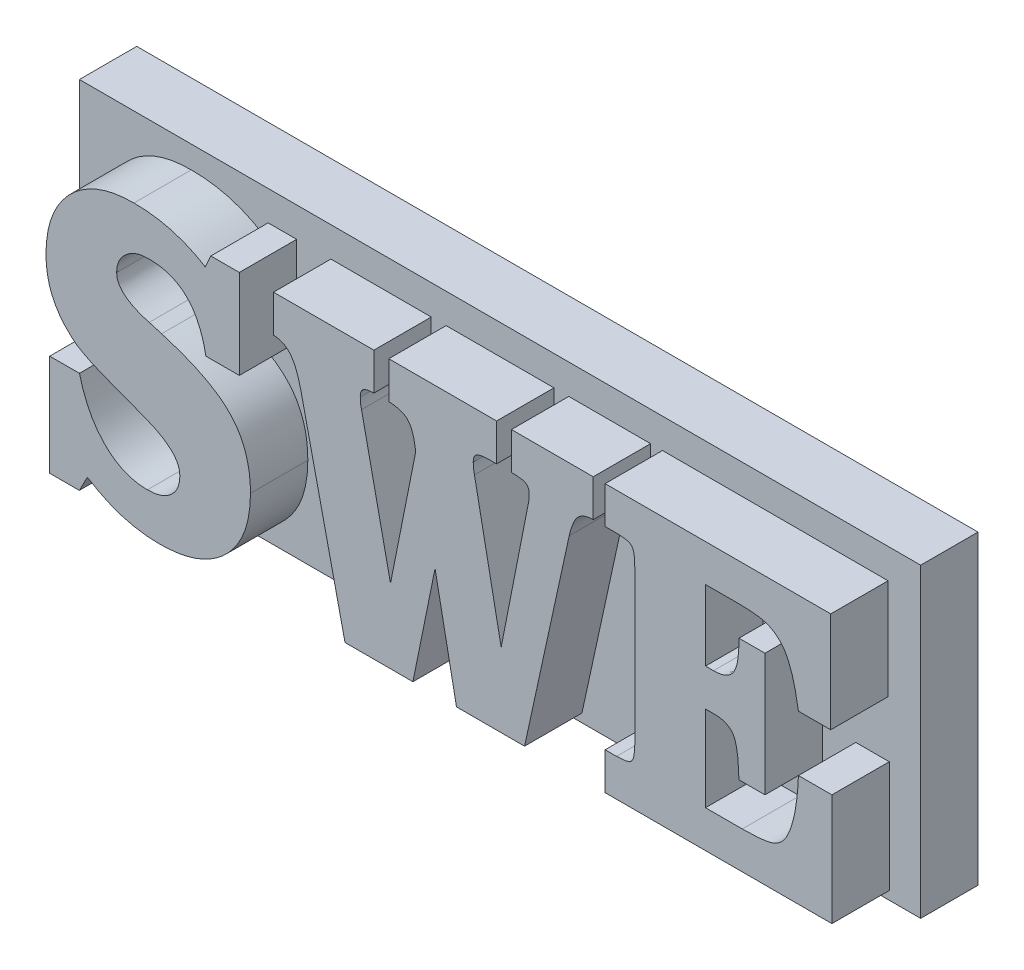
from build123d import *

# Parameters (mm, degrees)
SKETCH1_W           = 139.7
SKETCH1_H           = 50.8
BOSS_EXTRUDE1_DEPTH = 9.525
BOSS_EXTRUDE2_DEPTH = 9.525
SKETCH3_W           = 3.302
SKETCH3_H           = 38.1
CUT_EXTRUDE1_DEPTH  = 6.35
BOSS_EXTRUDE4_DEPTH = 3.175
LPATTERN1_COUNT     = 3
LPATTERN1_PITCH     = 55.372


with BuildPart() as part:
    # Sketch1 → Boss-Extrude1 (new body)
    with BuildSketch(Plane.XY):
        Rectangle(SKETCH1_W, SKETCH1_H)
    extrude(amount=BOSS_EXTRUDE1_DEPTH)

    # Sketch2 → Boss-Extrude2 (add)
    with BuildSketch(Plane.XY.offset(9.525)):
        with BuildLine():
            Line((-65.255069444, -7.328035102), (-60.316180556, -7.328035102))
            add(Edge.make_bspline(
                [(-60.316180556, -7.328035102), (-60.206025525, -7.754110071), (-59.990466561, -8.587882972), (-59.57876222, -9.786605348), (-59.126462153, -10.917441051), (-58.628987413, -11.981915952), (-58.065668641, -12.970665932), (-57.450470062, -13.887133459), (-56.779903272, -14.729446916), (-56.071234499, -15.504683858), (-55.307240176, -16.186472595), (-54.513207402, -16.790958162), (-53.682092583, -17.306400474), (-52.81374909, -17.719662713), (-51.915062934, -18.041684677), (-50.985280985, -18.275443723), (-50.017943274, -18.410709827), (-49.361646539, -18.430523897), (-49.030047743, -18.440535102)],
                knots=[0, 0, 0, 0, 1.231253551, 2.409401909, 3.544062105, 4.638986449, 5.694903985, 6.725712604, 7.724967103, 8.705652409, 9.661497736, 10.586602625, 11.495680479, 12.393283466, 13.272841424, 14.163333945, 15.072010843, 16, 16, 16, 16], degree=3))
            add(Edge.make_bspline(
                [(-49.030047743, -18.440535102), (-48.642415448, -18.429261444), (-47.896741689, -18.407574729), (-46.846196868, -18.144033305), (-45.902115592, -17.755852062), (-45.107102547, -17.17500219), (-44.455423469, -16.473058093), (-43.9784677, -15.654499241), (-43.701871129, -14.727975053), (-43.666013533, -14.079085764), (-43.647430556, -13.742802897)],
                knots=[0, 0, 0, 0, 1.155836752, 2.223439966, 3.21785095, 4.188715844, 5.140993966, 6.062463377, 6.995883609, 8, 8, 8, 8], degree=3))
            add(Edge.make_bspline(
                [(-43.647430556, -13.742802897), (-43.663149577, -13.47353183), (-43.694649518, -12.933929379), (-43.987301758, -12.150306256), (-44.450953036, -11.411180065), (-45.095890512, -10.704764893), (-45.92633521, -10.05040994), (-46.919578166, -9.405114697), (-48.102646477, -8.815709507), (-48.963174589, -8.466653788), (-49.415898438, -8.283015571)],
                knots=[0, 0, 0, 0, 0.764697947, 1.532407066, 2.350892576, 3.239367693, 4.242159257, 5.354958224, 6.608443496, 8, 8, 8, 8], degree=3))
            add(Edge.make_bspline(
                [(-49.415898438, -8.283015571), (-49.711876164, -8.174140008), (-50.269574643, -7.968990327), (-51.056316502, -7.671942127), (-51.737318227, -7.388826368), (-52.161797757, -7.215314302), (-52.358009983, -7.135109755)],
                knots=[0, 0, 0, 0, 1.19820127, 2.257720648, 3.19464548, 4, 4, 4, 4], degree=3))
            add(Edge.make_bspline(
                [(-52.358009983, -7.135109755), (-52.976331133, -6.912601958), (-54.142496747, -6.492947962), (-55.770676846, -5.863185146), (-57.18054879, -5.301355015), (-58.375065119, -4.77547155), (-59.380771163, -4.282055322), (-60.223736674, -3.807913256), (-60.927397917, -3.362689203), (-61.321993318, -3.038975011), (-61.502671441, -2.890752116)],
                knots=[0, 0, 0, 0, 1.557479773, 2.937436884, 4.137546574, 5.154336823, 6.030273639, 6.791246119, 7.446533379, 8, 8, 8, 8], degree=3))
            add(Edge.make_bspline(
                [(-61.502671441, -2.890752116), (-61.856694647, -2.559818022), (-62.552580063, -1.9093177), (-63.463427304, -0.835586889), (-64.218824358, 0.300034071), (-64.837009478, 1.487953147), (-65.304341366, 2.748939002), (-65.625653794, 4.08676024), (-65.837208487, 5.504459978), (-65.860493543, 6.478196416), (-65.872430556, 6.977379394)],
                knots=[0, 0, 0, 0, 1.042021876, 2.048249421, 3.021008834, 3.970868383, 4.923042701, 5.906249433, 6.926645239, 8, 8, 8, 8], degree=3))
            add(Edge.make_bspline(
                [(-65.872430556, 6.977379394), (-65.863688391, 7.515049875), (-65.846562668, 8.568335384), (-65.643040257, 10.103358244), (-65.341866497, 11.566000675), (-64.894035891, 12.943364449), (-64.336619917, 14.246087746), (-63.64316236, 15.465120252), (-62.822174231, 16.600821584), (-61.887839301, 17.654646417), (-60.843509471, 18.598224413), (-59.716327277, 19.432529951), (-58.500216205, 20.129214182), (-57.210372119, 20.701136442), (-55.839785823, 21.146263128), (-54.389568888, 21.464427961), (-52.854590942, 21.646323448), (-51.805434989, 21.673840767), (-51.267981771, 21.68793712)],
                knots=[0, 0, 0, 0, 1.104369362, 2.163437066, 3.177052802, 4.169792589, 5.134757139, 6.084806065, 7.045893009, 8.010178405, 8.973965451, 9.933597097, 10.886927326, 11.848491309, 12.828656977, 13.843672126, 14.895373608, 16, 16, 16, 16], degree=3))
            add(Edge.make_bspline(
                [(-51.267981771, 21.68793712), (-50.720977514, 21.679718978), (-49.64079763, 21.663490455), (-48.052217957, 21.503751605), (-46.518448435, 21.253257858), (-45.03417623, 20.90710523), (-43.587976982, 20.4481291), (-42.165057386, 19.887817888), (-40.764886406, 19.214811723), (-39.865718817, 18.684847747), (-39.412719184, 18.417852485)],
                knots=[0, 0, 0, 0, 1.053163087, 2.079701514, 3.071259132, 4.044569555, 5.012051423, 5.990626845, 6.987680035, 8, 8, 8, 8], degree=3))
            Line((-39.412719184, 18.417852485), (-38.505970052, 20.453214898))
            Line((-38.505970052, 20.453214898), (-33.769652778, 20.453214898))
            Line((-33.769652778, 20.453214898), (-33.769652778, 5.636548231))
            Line((-33.769652778, 5.636548231), (-39.325902778, 5.636548231))
            add(Edge.make_bspline(
                [(-39.325902778, 5.636548231), (-39.403111047, 6.013420139), (-39.553731344, 6.748633605), (-39.826979311, 7.812396577), (-40.169421953, 8.794961297), (-40.541008128, 9.707565454), (-40.969017408, 10.542100707), (-41.439130765, 11.306495755), (-41.961250421, 11.995970149), (-42.535544136, 12.607916091), (-43.15177463, 13.148749295), (-43.81663345, 13.619788669), (-44.533329969, 14.013408837), (-45.297363484, 14.34426942), (-46.115556828, 14.597036876), (-46.982840427, 14.76405058), (-47.898610043, 14.874807227), (-48.524885199, 14.889442751), (-48.846768663, 14.896964898)],
                knots=[0, 0, 0, 0, 1.258218904, 2.454572661, 3.588660999, 4.658929361, 5.674857675, 6.652506382, 7.590609066, 8.498333102, 9.392677741, 10.268023514, 11.157718633, 12.06220809, 12.986952302, 13.952191341, 14.947498176, 16, 16, 16, 16], degree=3))
            add(Edge.make_bspline(
                [(-48.846768663, 14.896964898), (-49.214763377, 14.88053864), (-49.927731266, 14.848713742), (-50.948089956, 14.595774779), (-51.863996675, 14.162444478), (-52.657772801, 13.574706415), (-53.32418596, 12.876959679), (-53.791959807, 12.068482656), (-54.090431306, 11.184261014), (-54.124896844, 10.564998163), (-54.142569444, 10.24746403)],
                knots=[0, 0, 0, 0, 1.123411795, 2.176543594, 3.187262406, 4.199174087, 5.179254974, 6.112682691, 7.032256392, 8, 8, 8, 8], degree=3))
            add(Edge.make_bspline(
                [(-54.142569444, 10.24746403), (-54.125069674, 10.007467564), (-54.09004024, 9.527064694), (-53.827707042, 8.834181487), (-53.382229462, 8.205656408), (-52.779118202, 7.620768698), (-52.006185142, 7.08152977), (-51.062459, 6.596446541), (-49.957519971, 6.152179294), (-49.154594414, 5.915662324), (-48.731013455, 5.790888509)],
                knots=[0, 0, 0, 0, 0.765480928, 1.532269372, 2.329795358, 3.208411909, 4.202777607, 5.328122593, 6.590459119, 8, 8, 8, 8], degree=3))
            add(Edge.make_bspline(
                [(-48.731013455, 5.790888509), (-48.521934587, 5.730056169), (-48.126253008, 5.614931017), (-47.574382501, 5.450113462), (-47.092598237, 5.317727308), (-46.801524783, 5.225766094), (-46.66671224, 5.183173665)],
                knots=[0, 0, 0, 0, 1.214236487, 2.29794152, 3.211680661, 4, 4, 4, 4], degree=3))
            add(Edge.make_bspline(
                [(-46.66671224, 5.183173665), (-46.009155054, 4.98241757), (-44.737779437, 4.59425908), (-42.920317879, 3.949558374), (-41.256059562, 3.263561768), (-39.740265351, 2.548672279), (-38.384642964, 1.78045717), (-37.171332991, 0.995228205), (-36.112442426, 0.165125196), (-35.200515056, -0.714019524), (-34.417659955, -1.651959315), (-33.746868424, -2.665530375), (-33.179944908, -3.75563566), (-32.708764756, -4.926919606), (-32.361241533, -6.180848016), (-32.096878704, -7.511784415), (-31.941877753, -8.922408855), (-31.925800549, -9.890344389), (-31.917569444, -10.385901856)],
                knots=[0, 0, 0, 0, 1.405326317, 2.717174493, 3.940260391, 5.083920495, 6.140535383, 7.123167863, 8.035770652, 8.886431626, 9.707817004, 10.528176062, 11.366069425, 12.215586884, 13.104009193, 14.021828313, 14.987228266, 16, 16, 16, 16], degree=3))
            add(Edge.make_bspline(
                [(-31.917569444, -10.385901856), (-31.930807461, -10.936294739), (-31.956748167, -12.014823346), (-32.151420281, -13.587323516), (-32.470999453, -15.075409081), (-32.908080267, -16.479339229), (-33.496278553, -17.791692342), (-34.200625315, -19.022163987), (-35.035233796, -20.170209962), (-36.00075344, -21.216900731), (-37.069259681, -22.163084419), (-38.234222953, -22.986340368), (-39.485312316, -23.690193994), (-40.834367798, -24.241359829), (-42.262093951, -24.692131533), (-43.783588467, -25.009212562), (-45.395484925, -25.189206258), (-46.499064776, -25.217214853), (-47.062209201, -25.231507325)],
                knots=[0, 0, 0, 0, 1.102677699, 2.160764573, 3.169214225, 4.149335839, 5.101180398, 6.044988119, 6.985756052, 7.93882098, 8.892843676, 9.840316939, 10.792161498, 11.762578277, 12.754990297, 13.788646949, 14.871571329, 16, 16, 16, 16], degree=3))
            add(Edge.make_bspline(
                [(-47.062209201, -25.231507325), (-47.58670556, -25.219600904), (-48.628592457, -25.195949371), (-50.177108241, -25.030122674), (-51.694168647, -24.746570054), (-53.190601849, -24.3649072), (-54.658721793, -23.843049588), (-56.125088489, -23.226180484), (-57.579300417, -22.482449124), (-58.525244172, -21.912457832), (-59.004288194, -21.623803331)],
                knots=[0, 0, 0, 0, 0.995210939, 1.976938869, 2.951072253, 3.921875125, 4.904057998, 5.904715443, 6.938907796, 8, 8, 8, 8], degree=3))
            Line((-59.004288194, -21.623803331), (-60.33547309, -24.180064182))
            Line((-60.33547309, -24.180064182), (-65.255069444, -24.180064182))
            Line((-65.255069444, -24.180064182), (-65.255069444, -7.328035102))
        make_face()
        with BuildLine():
            Line((-11.421180556, 20.453214898), (-11.421180556, 14.279603787))
            add(Edge.make_bspline(
                [(-11.421180556, 14.279603787), (-11.610977978, 14.272810398), (-11.962979758, 14.260211256), (-12.45191003, 14.201671024), (-12.853692811, 14.076905242), (-13.175867189, 13.905818129), (-13.414493279, 13.666064698), (-13.581238388, 13.366938175), (-13.676825085, 12.999115589), (-13.684139807, 12.733577297), (-13.688053385, 12.591506998)],
                knots=[0, 0, 0, 0, 1.395244211, 2.58764549, 3.603480976, 4.470607483, 5.238818178, 6.053200698, 6.95840876, 8, 8, 8, 8], degree=3))
            add(Edge.make_bspline(
                [(-13.688053385, 12.591506998), (-13.686954838, 12.440288075), (-13.684777302, 12.140542767), (-13.644676266, 11.699121876), (-13.581184495, 11.275797964), (-13.510311512, 11.005807624), (-13.475835503, 10.874471408)],
                knots=[0, 0, 0, 0, 1.04503232, 2.071457236, 3.061864555, 4, 4, 4, 4], degree=3))
            Line((-13.475835503, 10.874471408), (-8.66234809, -11.707440484))
            Line((-8.66234809, -11.707440484), (-4.466221788, 9.350361165))
            add(Edge.make_bspline(
                [(-4.466221788, 9.350361165), (-4.534450496, 9.792738978), (-4.660159373, 10.607803787), (-4.957678108, 11.700427477), (-5.296119055, 12.574757002), (-5.752333385, 13.228970836), (-6.33083014, 13.706195004), (-7.066961655, 14.01606099), (-7.952890354, 14.229918851), (-8.602961543, 14.26225492), (-8.951736111, 14.279603787)],
                knots=[0, 0, 0, 0, 1.419748928, 2.615835049, 3.590281252, 4.38056955, 5.12032733, 5.938089543, 6.893748958, 8, 8, 8, 8], degree=3))
            Line((-8.951736111, 14.279603787), (-8.951736111, 20.453214898))
            Line((-8.951736111, 20.453214898), (8.951736111, 20.453214898))
            Line((8.951736111, 20.453214898), (8.951736111, 14.279603787))
            Line((8.951736111, 14.279603787), (7.765245226, 14.279603787))
            add(Edge.make_bspline(
                [(7.765245226, 14.279603787), (7.517314517, 14.279146563), (7.068164141, 14.27831826), (6.46123246, 14.197113216), (5.983648008, 14.093503392), (5.616975442, 13.931320749), (5.368569292, 13.685319423), (5.185687526, 13.386727367), (5.098271099, 13.007549745), (5.082416233, 12.736481476), (5.073936632, 12.591506998)],
                knots=[0, 0, 0, 0, 1.614814763, 2.925392586, 3.983012039, 4.798745871, 5.495639792, 6.229099474, 7.052875569, 8, 8, 8, 8], degree=3))
            add(Edge.make_bspline(
                [(5.073936632, 12.591506998), (5.075980715, 12.472490644), (5.080184947, 12.227699942), (5.110378449, 11.841037341), (5.173083043, 11.386673068), (5.238929588, 11.060575478), (5.276508247, 10.874471408)],
                knots=[0, 0, 0, 0, 0.824492911, 1.695802228, 2.684993094, 4, 4, 4, 4], degree=3))
            Line((5.276508247, 10.874471408), (9.713791233, -11.707440484))
            Line((9.713791233, -11.707440484), (14.170366753, 10.94199528))
            add(Edge.make_bspline(
                [(14.170366753, 10.94199528), (14.205372655, 11.099071695), (14.272156326, 11.398739445), (14.32319396, 11.835288356), (14.368706306, 12.227224893), (14.37159223, 12.475635841), (14.372938368, 12.591506998)],
                knots=[0, 0, 0, 0, 1.158867595, 2.21086815, 3.165460378, 4, 4, 4, 4], degree=3))
            add(Edge.make_bspline(
                [(14.372938368, 12.591506998), (14.364926317, 12.742985505), (14.350240017, 13.02064957), (14.259937223, 13.410011855), (14.073651201, 13.713370844), (13.80558838, 13.953442709), (13.415385782, 14.101559846), (12.893423954, 14.21359119), (12.210127176, 14.272692732), (11.70096552, 14.277152912), (11.421180556, 14.279603787)],
                knots=[0, 0, 0, 0, 0.922312519, 1.690622976, 2.401556222, 3.052702959, 3.840909036, 4.903447889, 6.298440757, 8, 8, 8, 8], degree=3))
            Line((11.421180556, 14.279603787), (11.421180556, 20.453214898))
            Line((11.421180556, 20.453214898), (25.003125, 20.453214898))
            Line((25.003125, 20.453214898), (25.003125, 14.279603787))
            add(Edge.make_bspline(
                [(25.003125, 14.279603787), (24.738175569, 14.270783083), (24.233265273, 14.253973595), (23.525169408, 14.06516371), (22.912368364, 13.766958934), (22.391159782, 13.329691957), (21.974522398, 12.72740233), (21.598487373, 11.97029887), (21.266570707, 11.033475631), (21.099190276, 10.339366752), (21.009570312, 9.967722276)],
                knots=[0, 0, 0, 0, 0.975894957, 1.859748894, 2.682515055, 3.474304542, 4.340853951, 5.365344278, 6.589334796, 8, 8, 8, 8], degree=3))
            Line((21.009570312, 9.967722276), (13.601236979, -23.996785102))
            Line((13.601236979, -23.996785102), (2.295811632, -23.996785102))
            Line((2.295811632, -23.996785102), (-1.263661024, -5.861802463))
            Line((-1.263661024, -5.861802463), (-4.938888889, -23.996785102))
            Line((-4.938888889, -23.996785102), (-16.215375434, -23.996785102))
            Line((-16.215375434, -23.996785102), (-23.585123698, 8.761938856))
            add(Edge.make_bspline(
                [(-23.585123698, 8.761938856), (-23.700608963, 9.217181652), (-23.915892215, 10.065828004), (-24.315334412, 11.227377241), (-24.772498427, 12.179123453), (-25.280734253, 12.938598426), (-25.854774838, 13.530266656), (-26.528045149, 13.936151371), (-27.278765478, 14.212698246), (-27.814119621, 14.256854681), (-28.089930556, 14.279603787)],
                knots=[0, 0, 0, 0, 1.457125183, 2.716317498, 3.805176779, 4.724038734, 5.542494731, 6.340002271, 7.144780084, 8, 8, 8, 8], degree=3))
            Line((-28.089930556, 14.279603787), (-28.089930556, 20.453214898))
            Line((-28.089930556, 20.453214898), (-11.421180556, 20.453214898))
        make_face()
        with BuildLine():
            Line((64.444782986, 20.453214898), (64.444782986, 3.784464898))
            Line((64.444782986, 3.784464898), (59.081458333, 3.784464898))
            add(Edge.make_bspline(
                [(59.081458333, 3.784464898), (58.991712012, 4.306021233), (58.822820842, 5.287523972), (58.531683415, 6.664215706), (58.23817892, 7.859637945), (57.927719649, 8.890828705), (57.594265655, 9.786063301), (57.238745516, 10.581348936), (56.850743292, 11.292153848), (56.539623433, 11.707212306), (56.39014974, 11.906622016)],
                knots=[0, 0, 0, 0, 1.470166718, 2.766666924, 3.90846241, 4.889030304, 5.756829302, 6.560460776, 7.308391159, 8, 8, 8, 8], degree=3))
            add(Edge.make_bspline(
                [(56.39014974, 11.906622016), (56.215698916, 12.111415117), (55.872281966, 12.514562668), (55.265012164, 13.019701622), (54.60073275, 13.427769298), (53.857776979, 13.761599018), (52.967835059, 14.004479527), (51.881277897, 14.169789713), (50.568385407, 14.255701592), (49.618583398, 14.271238724), (49.107217882, 14.279603787)],
                knots=[0, 0, 0, 0, 0.809408414, 1.593369199, 2.36769273, 3.152670519, 4.038962434, 5.137956961, 6.459099792, 8, 8, 8, 8], degree=3))
            Line((49.107217882, 14.279603787), (48.075067274, 14.279603787))
            Line((48.075067274, 14.279603787), (43.647430556, 14.279603787))
            Line((43.647430556, 14.279603787), (43.647430556, 2.549742675))
            Line((43.647430556, 2.549742675), (44.978615451, 2.549742675))
            add(Edge.make_bspline(
                [(44.978615451, 2.549742675), (45.34037112, 2.564012589), (46.017004659, 2.59070326), (46.955341773, 2.847709682), (47.715624577, 3.302716414), (48.206271356, 3.830705686), (48.495451574, 4.34465678), (48.685340014, 4.798953817), (48.850531285, 5.318305855), (48.985474266, 5.905129528), (49.073211495, 6.564446236), (49.15723031, 7.287361035), (49.187687963, 8.080054747), (49.198207784, 8.630117601), (49.203680556, 8.916279134)],
                knots=[0, 0, 0, 0, 1.472985814, 2.755096023, 3.919695013, 5.04229159, 5.647173646, 6.316780532, 7.046445637, 7.866909877, 8.767936898, 9.756719549, 10.832968694, 12, 12, 12, 12], degree=3))
            Line((49.203680556, 8.916279134), (49.203680556, 9.340714898))
            Line((49.203680556, 9.340714898), (53.525208333, 9.340714898))
            Line((53.525208333, 9.340714898), (53.525208333, -11.032201769))
            Line((53.525208333, -11.032201769), (49.203680556, -11.032201769))
            add(Edge.make_bspline(
                [(49.203680556, -11.032201769), (49.192656922, -10.662351826), (49.171653547, -9.957675204), (49.112981512, -8.95096641), (49.039658934, -8.043101145), (48.938159802, -7.237409056), (48.801649378, -6.53586953), (48.648840574, -5.936283868), (48.48346937, -5.430390924), (48.215697532, -4.900221066), (47.758931466, -4.365094069), (47.01321151, -3.917919009), (46.078255337, -3.6635261), (45.39508492, -3.637757865), (45.026846788, -3.623868436)],
                knots=[0, 0, 0, 0, 1.356874136, 2.58525789, 3.697691687, 4.696657543, 5.56156633, 6.316608312, 6.965477433, 7.508667552, 8.487100669, 9.498309804, 10.651555012, 12, 12, 12, 12], degree=3))
            Line((45.026846788, -3.623868436), (43.647430556, -3.623868436))
            Line((43.647430556, -3.623868436), (43.647430556, -17.823173991))
            Line((43.647430556, -17.823173991), (49.753517795, -17.823173991))
            add(Edge.make_bspline(
                [(49.753517795, -17.823173991), (50.052603477, -17.821876185), (50.628415246, -17.819377597), (51.45456742, -17.78516504), (52.208416006, -17.756469872), (52.886010519, -17.681440937), (53.495572453, -17.611143761), (54.031781402, -17.51118156), (54.500319624, -17.414748646), (55.013020422, -17.23125081), (55.577075767, -16.946505334), (56.172371705, -16.505623713), (56.695843815, -15.972500684), (56.960297658, -15.549049237), (57.094327257, -15.334437012)],
                knots=[0, 0, 0, 0, 1.316783262, 2.535124025, 3.640910214, 4.636923131, 5.536048713, 6.341446627, 7.038654231, 7.638665504, 8.734070204, 9.807290938, 10.888698634, 12, 12, 12, 12], degree=3))
            add(Edge.make_bspline(
                [(57.094327257, -15.334437012), (57.234151826, -15.050389658), (57.522808412, -14.463996723), (57.876570152, -13.510250927), (58.178044077, -12.470041151), (58.456650406, -11.33588995), (58.673809916, -10.078410177), (58.854182243, -8.678331066), (59.000652805, -7.127732878), (59.053759168, -6.042162514), (59.081458333, -5.475951769)],
                knots=[0, 0, 0, 0, 0.749528944, 1.547342268, 2.405239331, 3.314092216, 4.312076594, 5.425866755, 6.65738606, 8, 8, 8, 8], degree=3))
            Line((59.081458333, -5.475951769), (64.637708333, -5.475951769))
            Line((64.637708333, -5.475951769), (64.637708333, -23.996785102))
            Line((64.637708333, -23.996785102), (26.978680556, -23.996785102))
            Line((26.978680556, -23.996785102), (26.978680556, -17.823173991))
            Line((26.978680556, -17.823173991), (28.869348958, -17.823173991))
            add(Edge.make_bspline(
                [(28.869348958, -17.823173991), (29.1555662, -17.814951098), (29.675316845, -17.800018894), (30.380387455, -17.717439025), (30.923871687, -17.547173596), (31.366719098, -17.295400261), (31.642482853, -16.813623706), (31.804104138, -16.135916706), (31.899338481, -15.211475463), (31.91101972, -14.511491552), (31.917569444, -14.119007325)],
                knots=[0, 0, 0, 0, 1.179585417, 2.142045239, 2.90827458, 3.521635446, 4.182728119, 5.117560584, 6.383802842, 8, 8, 8, 8], degree=3))
            Line((31.917569444, -14.119007325), (31.917569444, -13.791034234))
            Line((31.917569444, -13.791034234), (31.917569444, 10.671899794))
            add(Edge.make_bspline(
                [(31.917569444, 10.671899794), (31.909602709, 11.044908125), (31.89535232, 11.712121704), (31.813939146, 12.598938115), (31.654320234, 13.25156342), (31.404628194, 13.732205923), (30.970677687, 14.000937375), (30.407873691, 14.162787253), (29.673134718, 14.260604656), (29.123659373, 14.272857408), (28.821117622, 14.279603787)],
                knots=[0, 0, 0, 0, 1.545919209, 2.765241959, 3.676399939, 4.327396705, 4.940648301, 5.724093829, 6.746883469, 8, 8, 8, 8], degree=3))
            Line((28.821117622, 14.279603787), (26.978680556, 14.279603787))
            Line((26.978680556, 14.279603787), (26.978680556, 20.453214898))
            Line((26.978680556, 20.453214898), (64.444782986, 20.453214898))
        make_face()
    extrude(amount=BOSS_EXTRUDE2_DEPTH)

    # Sketch3 → Cut-Extrude1 (cut)
    with BuildSketch(Plane(origin=(0, 0, 0), x_dir=(-1, 0, 0), z_dir=(0, 0, -1))):
        with Locations((-66.675, 0)):
            Rectangle(SKETCH3_W, SKETCH3_H)
        with Locations((66.675, 0)):
            Rectangle(SKETCH3_W, SKETCH3_H)
    extrude(amount=-CUT_EXTRUDE1_DEPTH, mode=Mode.SUBTRACT)

    # Sketch6 → Boss-Extrude4 (add)
    with BuildSketch(Plane(origin=(0, 7.62, 0), x_dir=(1, 0, 0), z_dir=(0, 1, 0))):
        with BuildLine():
            ThreePointArc((51.378019861, 2.852263638), (50.863627196, 1.361553073), (50.068019861, 0))
            Line((50.068019861, 0), (60.228019861, 0))
            ThreePointArc((60.228019861, 0), (59.432412526, 1.361553073), (58.918019861, 2.852263638))
            ThreePointArc((58.918019861, 2.852263638), (58.564800218, 4.445534485), (57.57132915, 5.740251188))
            Line((57.57132915, 5.740251188), (56.754988885, 4.767374746))
            ThreePointArc((56.754988885, 4.767374746), (55.148019861, 0.352263638), (53.541050837, 4.767374746))
            Line((53.541050837, 4.767374746), (52.724710573, 5.740251188))
            ThreePointArc((52.724710573, 5.740251188), (51.731239504, 4.445534485), (51.378019861, 2.852263638))
        make_face()
    boss_extrude4 = extrude(amount=BOSS_EXTRUDE4_DEPTH)

    # LPattern1: Boss-Extrude4 ×3
    with Locations(*[(-i * LPATTERN1_PITCH, 0, 0) for i in range(1, LPATTERN1_COUNT)]):
        add(boss_extrude4)


solid = part.part
